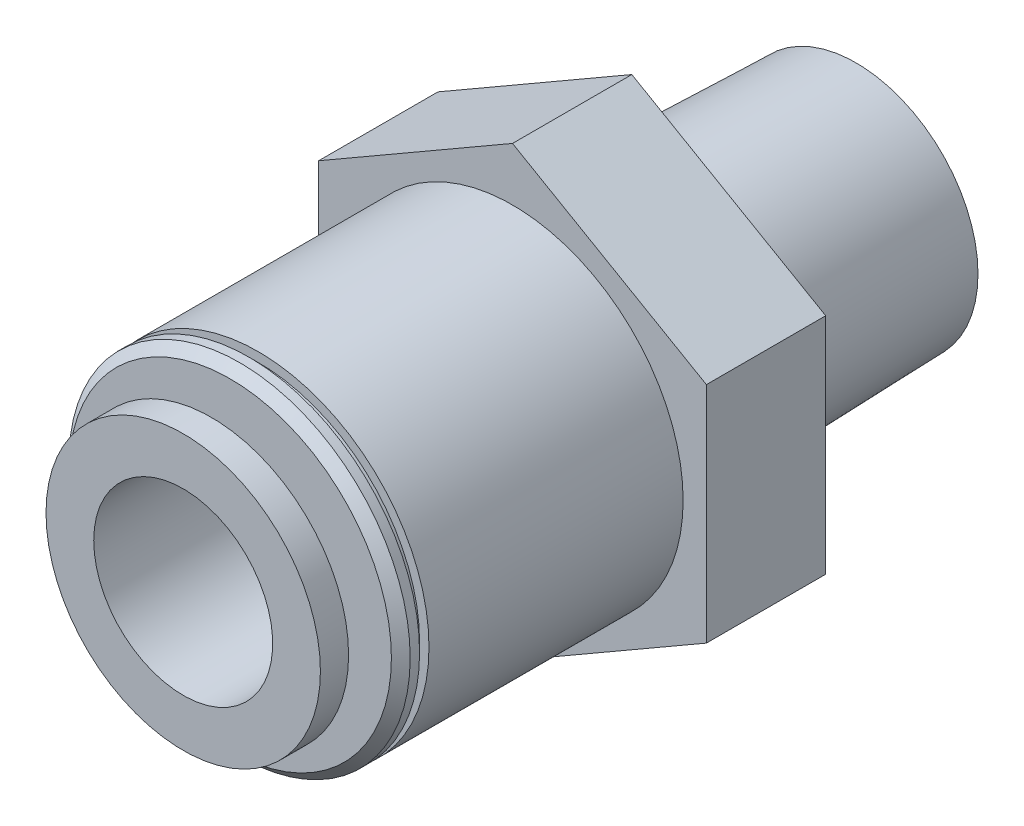
from build123d import *

# Parameters (mm, degrees)
BOSS_EXTRUDE1_DEPTH = 6.35
SKETCH5_R           = 6.858
BOSS_EXTRUDE2_DEPTH = 11.938
BOSS_EXTRUDE2_TAPER = 1.783333333


with BuildPart() as part:
    # Sketch2 → Revolve1 (revolve)
    with BuildSketch(Plane(origin=(0, 0, 0), x_dir=(0, 0, -1), z_dir=(1, 0, 0)), mode=Mode.PRIVATE) as revolve1_sk:
        Polygon((-23.876, 0), (-6.35, 0), (-6.35, 9.0805), (-19.876, 9.0805), (-19.876, 8.5805), (-20.376, 8.5805), (-20.376, 9.0805), (-20.876, 9.0805), (-21.376, 8.5805), (-21.376, 5.3975), (-22.376, 5.3975), (-22.376, 7.3025), (-23.876, 7.3025), align=None)
    revolve(revolve1_sk.sketch.rotate(Axis((0, 0, 23.876), (0, 0, -1)), 90), axis=Axis((0, 0, 23.876), (0, 0, -1)))

    # Sketch3 → Boss-Extrude1 (add)
    with BuildSketch(Plane(origin=(0, 0, 6.35), x_dir=(-1, 0, 0), z_dir=(0, 0, -1))):
        Polygon((0, 11.91506618), (-10.31875, 5.95753309), (-10.31875, -5.95753309), (0, -11.91506618), (10.31875, -5.95753309), (10.31875, 5.95753309), align=None)
    extrude(amount=BOSS_EXTRUDE1_DEPTH)


with BuildPart() as body_2:
    # Sketch5 → Boss-Extrude2 (new body)
    with BuildSketch(Plane(origin=(0, 0, 0), x_dir=(-1, 0, 0), z_dir=(0, 0, -1))):
        Circle(SKETCH5_R)
    extrude(amount=BOSS_EXTRUDE2_DEPTH, taper=BOSS_EXTRUDE2_TAPER)


with BuildPart() as part_1:
    add(part.part)

    # Combine1: union body 2
    add(body_2.part)

    # Sketch9 → Cut-Revolve2 (revolve, cut)
    with BuildSketch(Plane(origin=(0, 0, 0), x_dir=(0, 0, -1), z_dir=(1, 0, 0)), mode=Mode.PRIVATE) as cut_revolve2_sk:
        Polygon((-23.876, 4.7625), (-1.905, 4.7625), (-1.905, 3.81), (-0.956760375, 3.81), (-0.468380864, 4.6228), (11.938, 4.6228), (11.938, 0), (-23.876, 0), align=None)
    revolve(cut_revolve2_sk.sketch.rotate(Axis((0, 0, -11.938), (0, 0, 1)), 90), axis=Axis((0, 0, -11.938), (0, 0, 1)), mode=Mode.SUBTRACT)


solid = part_1.part
